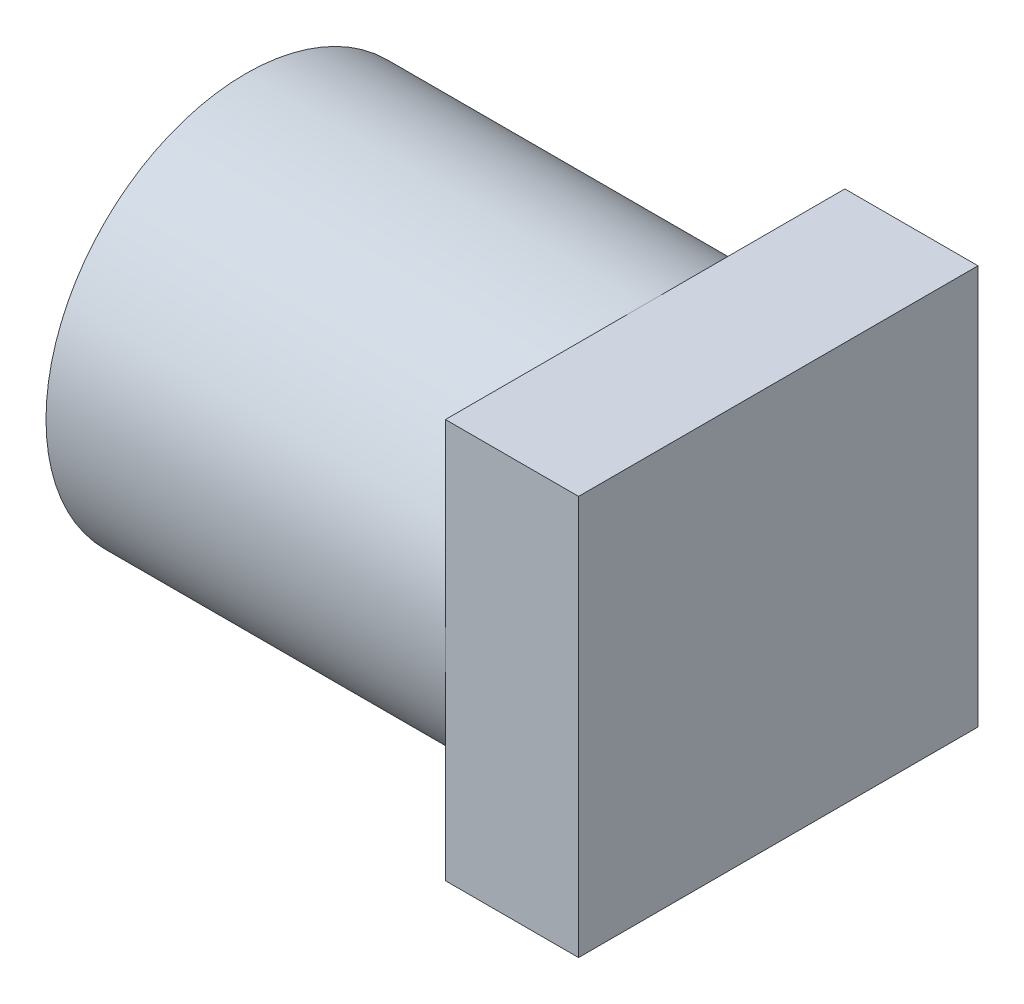
from build123d import *

# Parameters (mm, degrees)
SKETCH1_R           = 15
BOSS_EXTRUDE1_DEPTH = 30
SKETCH2_W           = 30
SKETCH2_H           = 30
BOSS_EXTRUDE2_DEPTH = 10


with BuildPart() as part:
    # Sketch1 → Boss-Extrude1 (new body)
    with BuildSketch(Plane(origin=(0, 0, 0), x_dir=(0, 0, -1), z_dir=(1, 0, 0))):
        Circle(SKETCH1_R)
    extrude(amount=BOSS_EXTRUDE1_DEPTH)

    # Sketch2 → Boss-Extrude2 (add)
    with BuildSketch(Plane(origin=(30, 0, 0), x_dir=(0, 0, -1), z_dir=(1, 0, 0))):
        Rectangle(SKETCH2_W, SKETCH2_H)
    extrude(amount=BOSS_EXTRUDE2_DEPTH)


solid = part.part
